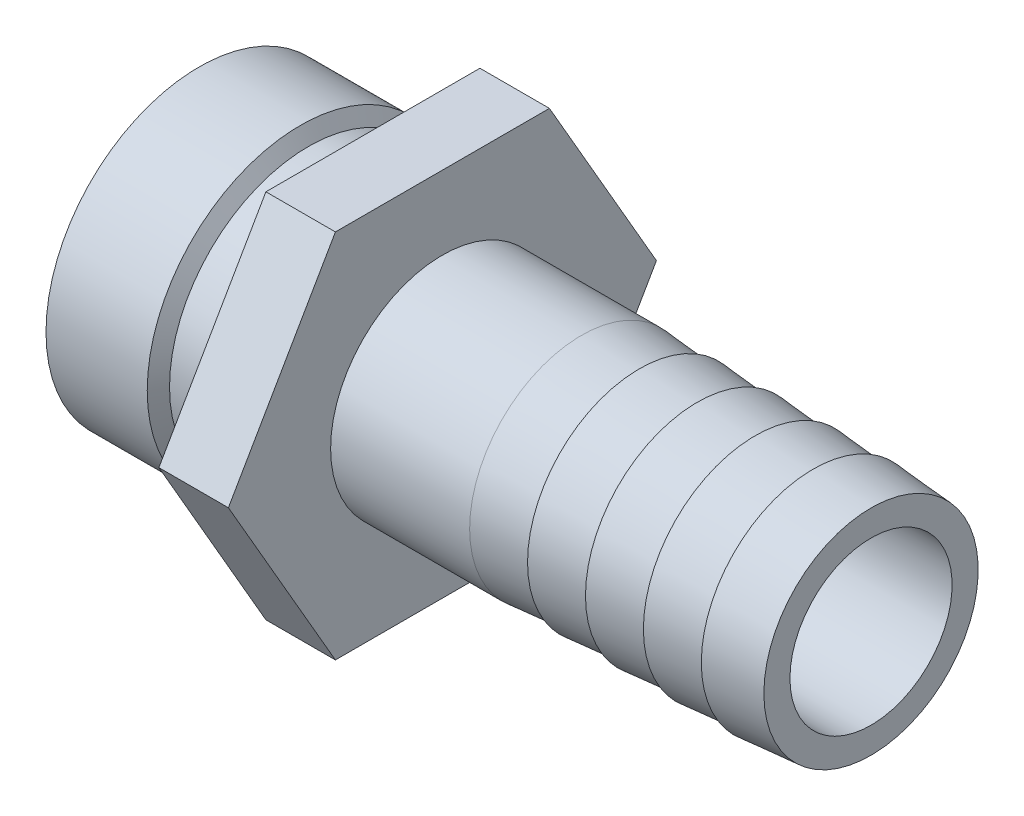
from build123d import *

# Parameters (mm, degrees)
LINEAR_AUSTRAGEN1_DEPTH = 6


with BuildPart() as part:
    # Skizze2 → Rotation1 (revolve)
    with BuildSketch(Plane.XY):
        Polygon((5, 13.22), (5, 9.65), (21, 9.65), (23, 9.65), (28, 9.25), (28, 9.65), (33, 9.25), (33, 9.65), (38, 9.25), (38, 9.65), (43, 9.25), (43, 9.65), (48, 9.25), (48, 7), (-10, 7), (-10, 13.22), align=None)
    revolve(axis=Axis((-12.825745381, 0, 0), (1, 0, 0)))

    # Skizze4 → Linear austragen1 (add)
    with BuildSketch(Plane.ZY.offset(-5)):
        Polygon((9.237604307, -16), (18.475208614, 0), (9.237604307, 16), (-9.237604307, 16), (-18.475208614, 0), (-9.237604307, -16), align=None)
    extrude(amount=-LINEAR_AUSTRAGEN1_DEPTH)

    # Skizze5 → Schnitt-Rotation1 (revolve, cut)
    with BuildSketch(Plane.XY):
        Polygon((-2, 14.5), (-0.556624327, 12), (5, 12), (5, 14.5), align=None)
    revolve(axis=Axis((-12.825745381, 0, 0), (1, 0, 0)), mode=Mode.SUBTRACT)


solid = part.part
